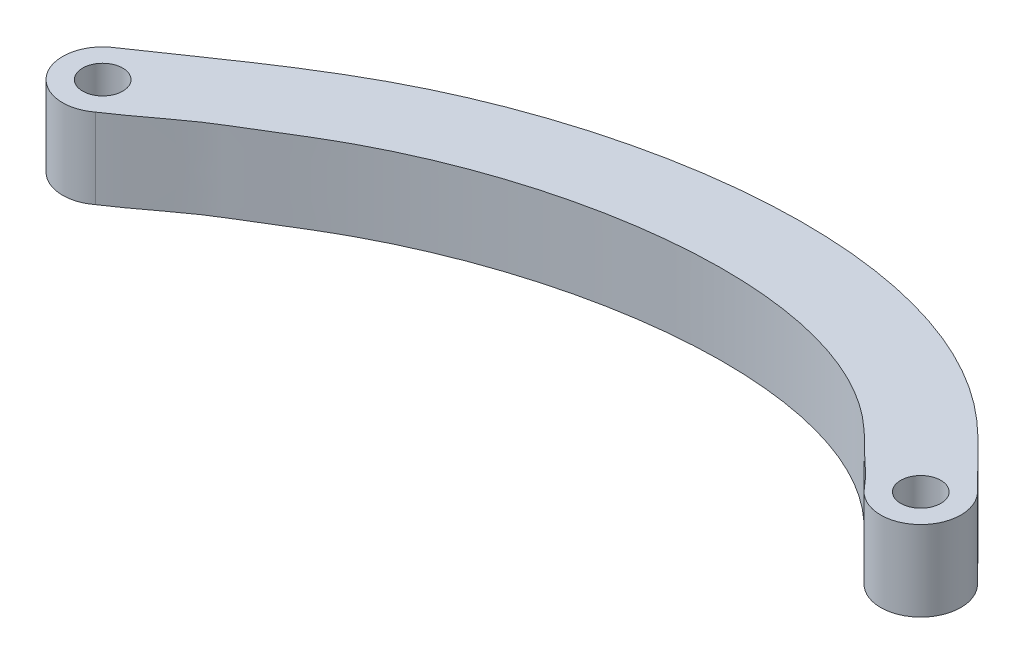
from build123d import *

# Parameters (mm, degrees)
SKETCH3_R           = 2.5
BOSS_EXTRUDE1_DEPTH = 5


with BuildPart() as part:
    # Sketch3 → Boss-Extrude1 (new, symmetric)
    with BuildSketch(Plane(origin=(0, 0, 0), x_dir=(1, 0, 0), z_dir=(0, 1, 0))):
        with BuildLine():
            ThreePointArc((-299.304262271, -16.226721188), (-300.203551691, -23.240370633), (-293.189902246, -24.139660053))
            add(Edge.make_bspline(
                [(-293.189902246, -24.139660053), (-290.128839124, -22.152764654), (-286.786538548, -19.324569113), (-280.862415348, -15.772118685), (-277.679116824, -13.712833567), (-272.928108533, -11.095078383), (-271.482849503, -10.354977079), (-268.484875372, -8.943526758), (-266.938163872, -8.274068128), (-262.188625232, -6.393042897), (-258.876334977, -5.309399198), (-251.271297793, -3.340810571), (-246.946091648, -2.580398934), (-238.485670472, -1.8527763), (-234.351862704, -1.886732872), (-227.640002948, -2.679148904), (-224.938371935, -3.245106431), (-219.9462539, -4.822827696), (-217.657198787, -5.832393233), (-214.770366393, -7.547047403), (-213.983977581, -8.069354524), (-212.538495104, -9.142025189), (-211.885373774, -9.678435733), (-210.525303671, -10.902899744), (-209.829074095, -11.581843244), (-207.729080325, -13.751928889), (-205.990691886, -15.11177084), (-204.427137735, -17.040946949)],
                knots=[0.921170626, 0.921170626, 0.921170626, 0.921170626, 12.454240572, 12.454240572, 24.908481145, 24.908481145, 30.226790488, 30.226790488, 35.545099832, 35.545099832, 46.181718519, 46.181718519, 59.564678371, 59.564678371, 72.947638222, 72.947638222, 82.838572761, 82.838572761, 92.7295073, 92.7295073, 96.661223853, 96.661223853, 100.281277534, 100.281277534, 103.901331215, 103.901331215, 110.926910792, 110.926910792, 110.926910792, 110.926910792], degree=3))
            ThreePointArc((-204.427137735, -17.040946949), (-197.365842369, -17.412575466), (-196.994213851, -10.3512801))
            add(Edge.make_bspline(
                [(-299.304262271, -16.226721188), (-291.902418619, -11.239503023), (-266.277956185, 8.039114355), (-218.323545031, 13.623313869), (-199.941940379, -7.459509549), (-196.994213851, -10.3512801)],
                knots=[0.847787986, 0.847787986, 0.847787986, 0.847787986, 28.002368753, 98.488917849, 110.926910792, 110.926910792, 110.926910792, 110.926910792], degree=3))
        make_face()
        with Locations(Location((-296.247082258, -20.183190621, 0), (0, 0, 270))):
            Circle(SKETCH3_R, mode=Mode.SUBTRACT)
        with Locations(Location((-200.710675793, -13.696113524, 0), (0, 0, 270))):
            Circle(SKETCH3_R, mode=Mode.SUBTRACT)
    extrude(amount=BOSS_EXTRUDE1_DEPTH, both=True)


solid = part.part
